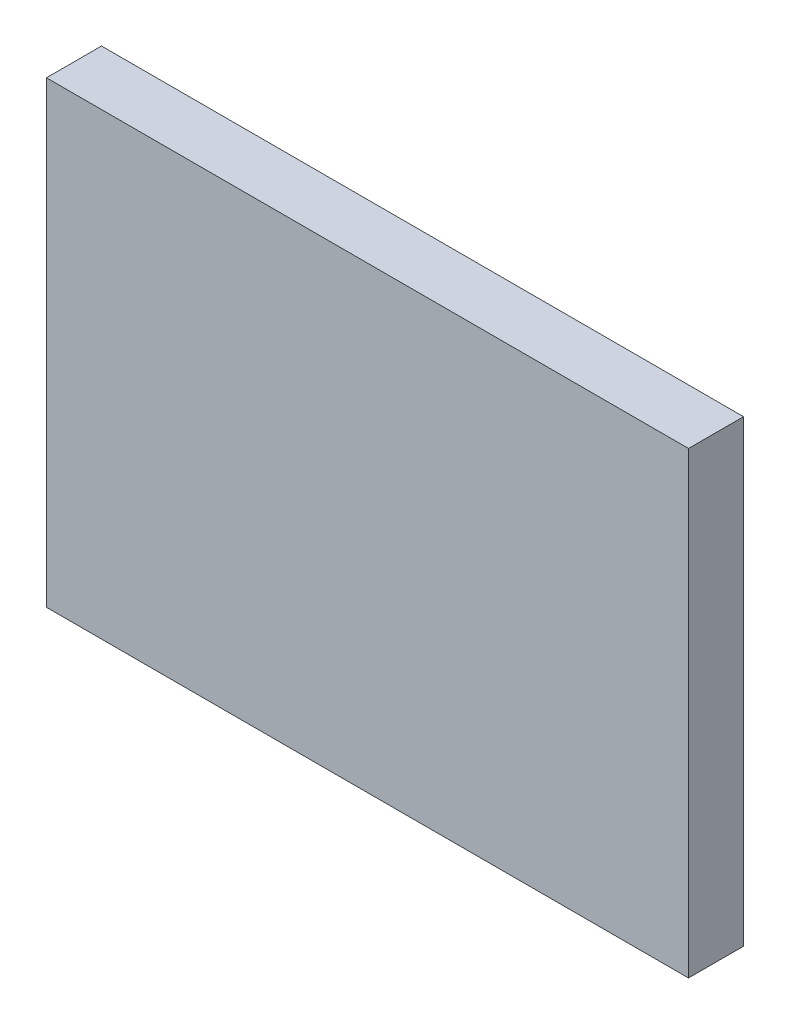
from build123d import *

# Parameters (mm, degrees)
SKETCH1_W      = 35
SKETCH1_H      = 25
MIRROR_2_DEPTH = 3


with BuildPart() as part:
    # Sketch1 → Mirror 2 (new body)
    with BuildSketch(Plane.XY):
        Rectangle(SKETCH1_W, SKETCH1_H)
    extrude(amount=MIRROR_2_DEPTH)


solid = part.part
